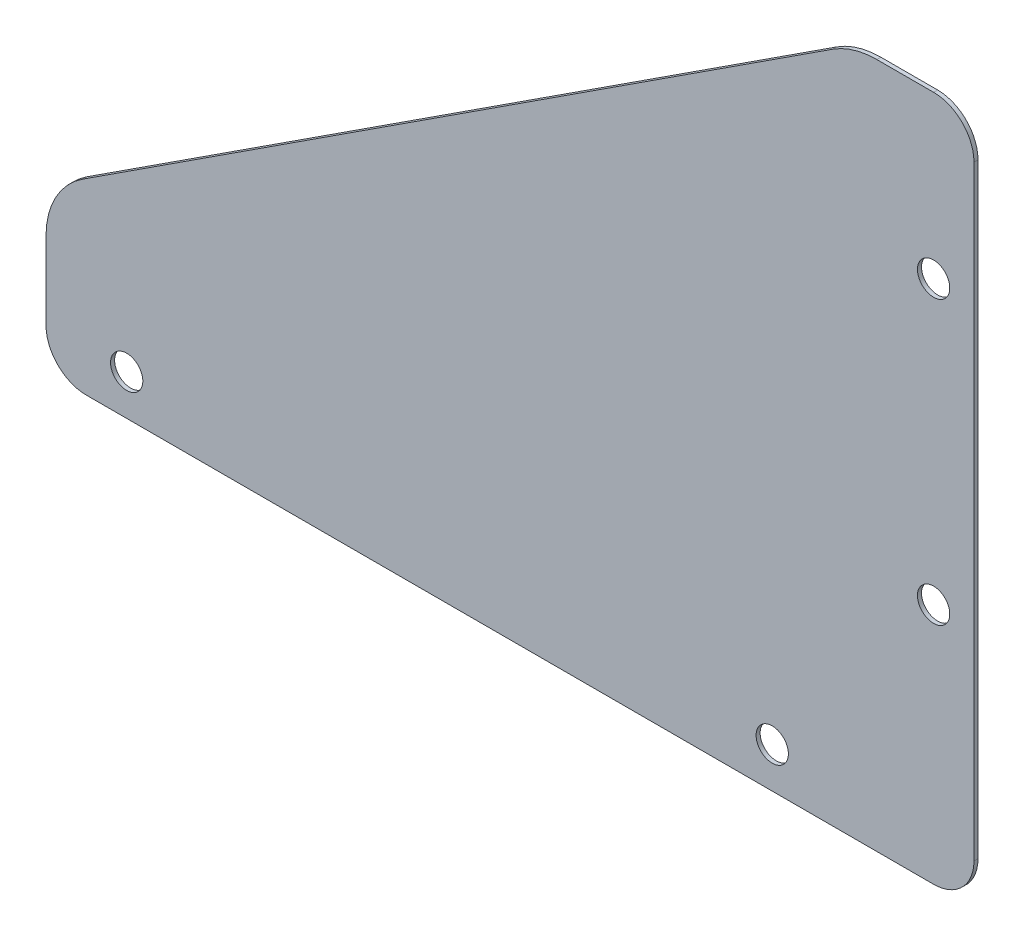
from build123d import *

# Parameters (mm, degrees)
SKETCH1_R           = 2
BOSS_EXTRUDE1_DEPTH = 0.5


with BuildPart() as part:
    # Sketch1 → Boss-Extrude1 (new body)
    with BuildSketch(Plane.XY):
        with BuildLine():
            Line((0, 5), (0, 80))
            ThreePointArc((0, 80), (-1.464466094, 83.535533906), (-5, 85))
            Line((-5, 85), (-12.03559932, 85))
            ThreePointArc((-12.03559932, 85), (-14.877749771, 84.587605583), (-17.485482826, 83.384436163))
            Line((-17.485482826, 83.384436163), (-110.449883506, 22.957575721))
            ThreePointArc((-110.449883506, 22.957575721), (-113.78916478, 19.342896624), (-115, 14.573139558))
            Line((-115, 14.573139558), (-115, 5))
            ThreePointArc((-115, 5), (-113.535533906, 1.464466094), (-110, 0))
            Line((-110, 0), (-5, 0))
            ThreePointArc((-5, 0), (-1.464466094, 1.464466094), (0, 5))
        make_face()
        with Locations((-105, 5)):
            Circle(SKETCH1_R, mode=Mode.SUBTRACT)
        with Locations((-25, 5)):
            Circle(SKETCH1_R, mode=Mode.SUBTRACT)
        with Locations((-5, 30)):
            Circle(SKETCH1_R, mode=Mode.SUBTRACT)
        with Locations((-5, 65)):
            Circle(SKETCH1_R, mode=Mode.SUBTRACT)
    extrude(amount=BOSS_EXTRUDE1_DEPTH)


solid = part.part
